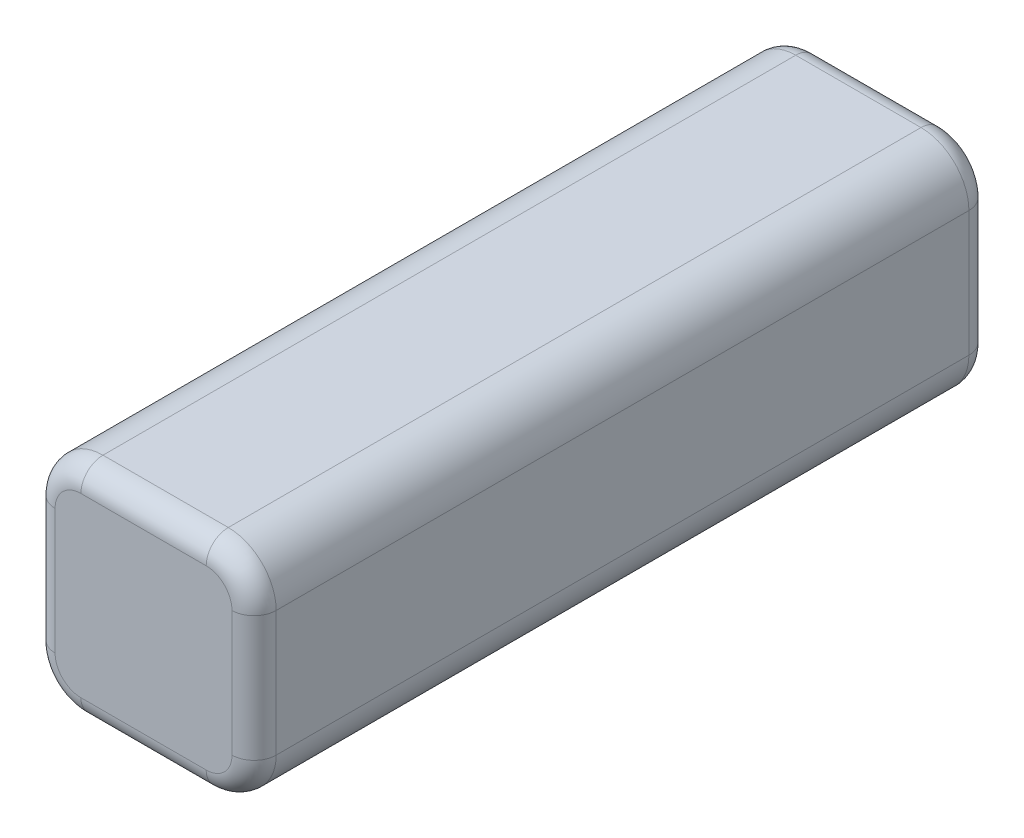
from build123d import *

# Parameters (mm, degrees)
RESSALTO_EXTRUS_O1_DEPTH = 10
FILETE1_R                = 0.3


with BuildPart() as part:
    # Esboço1 → Ressalto-extrusão1 (new body)
    with BuildSketch(Plane.XY):
        with BuildLine():
            Line((-0.85, 1.5), (0.85, 1.5))
            ThreePointArc((0.85, 1.5), (1.309619408, 1.309619408), (1.5, 0.85))
            Line((1.5, 0.85), (1.5, -0.85))
            ThreePointArc((1.5, -0.85), (1.309619408, -1.309619408), (0.85, -1.5))
            Line((0.85, -1.5), (-0.85, -1.5))
            ThreePointArc((-0.85, -1.5), (-1.309619408, -1.309619408), (-1.5, -0.85))
            Line((-1.5, -0.85), (-1.5, 0.85))
            ThreePointArc((-1.5, 0.85), (-1.309619408, 1.309619408), (-0.85, 1.5))
        make_face()
    extrude(amount=RESSALTO_EXTRUS_O1_DEPTH)

    # Filete1
    filete1_edges = [part.edges().sort_by_distance(p)[0] for p in [
        (0, -1.5, 0),
        (-1.309619408, -1.309619408, 0),
        (-1.5, 0, 0),
        (-1.309619408, 1.309619408, 0),
        (-1.309619408, -1.309619408, 10),
        (0, -1.5, 10),
        (1.309619408, -1.309619408, 10),
        (1.5, 0, 10),
        (1.309619408, 1.309619408, 10),
        (0, 1.5, 10),
        (-1.309619408, 1.309619408, 10),
        (0, 1.5, 0),
        (-1.5, 0, 10),
        (1.309619408, 1.309619408, 0),
        (1.5, 0, 0),
        (1.309619408, -1.309619408, 0),
    ]]
    fillet(filete1_edges, radius=FILETE1_R)


solid = part.part
